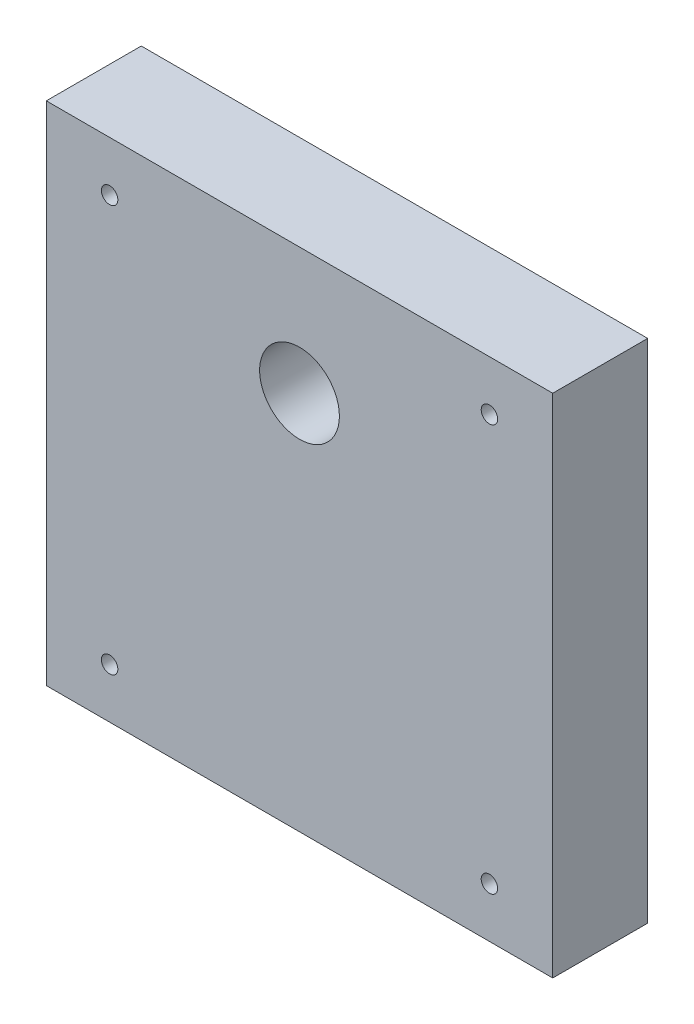
from build123d import *

# Parameters (mm, degrees)
SKETCH1_W           = 101.6
SKETCH1_H           = 101.6
BOSS_EXTRUDE1_DEPTH = 19.05
SKETCH2_R           = 8.001
CUT_EXTRUDE1_DEPTH  = 19.05
SKETCH3_R           = 1.651
CUT_EXTRUDE2_DEPTH  = 19.05
SKETCH4_R           = 1.651
CUT_EXTRUDE3_DEPTH  = 19.05


with BuildPart() as part:
    # Sketch1 → Boss-Extrude1 (new body)
    with BuildSketch(Plane.XY):
        Rectangle(SKETCH1_W, SKETCH1_H)
    extrude(amount=BOSS_EXTRUDE1_DEPTH)

    # Sketch2 → Cut-Extrude1 (cut)
    with BuildSketch(Plane.XY.offset(19.05)):
        with Locations((0, 25.4)):
            Circle(SKETCH2_R)
    extrude(amount=-CUT_EXTRUDE1_DEPTH, mode=Mode.SUBTRACT)

    # Sketch3 → Cut-Extrude2 (cut)
    with BuildSketch(Plane.XY.offset(19.05)):
        with Locations((-38.1, -40.767)):
            Circle(SKETCH3_R)
    extrude(amount=-CUT_EXTRUDE2_DEPTH, mode=Mode.SUBTRACT)

    # Sketch4 → Cut-Extrude3 (cut)
    with BuildSketch(Plane.XY.offset(19.05)):
        with Locations((-38.1, 40.767)):
            Circle(SKETCH4_R)
        with Locations((38.1, 40.767)):
            Circle(SKETCH4_R)
        with Locations((38.1, -40.767)):
            Circle(SKETCH4_R)
    extrude(amount=-CUT_EXTRUDE3_DEPTH, mode=Mode.SUBTRACT)


solid = part.part
